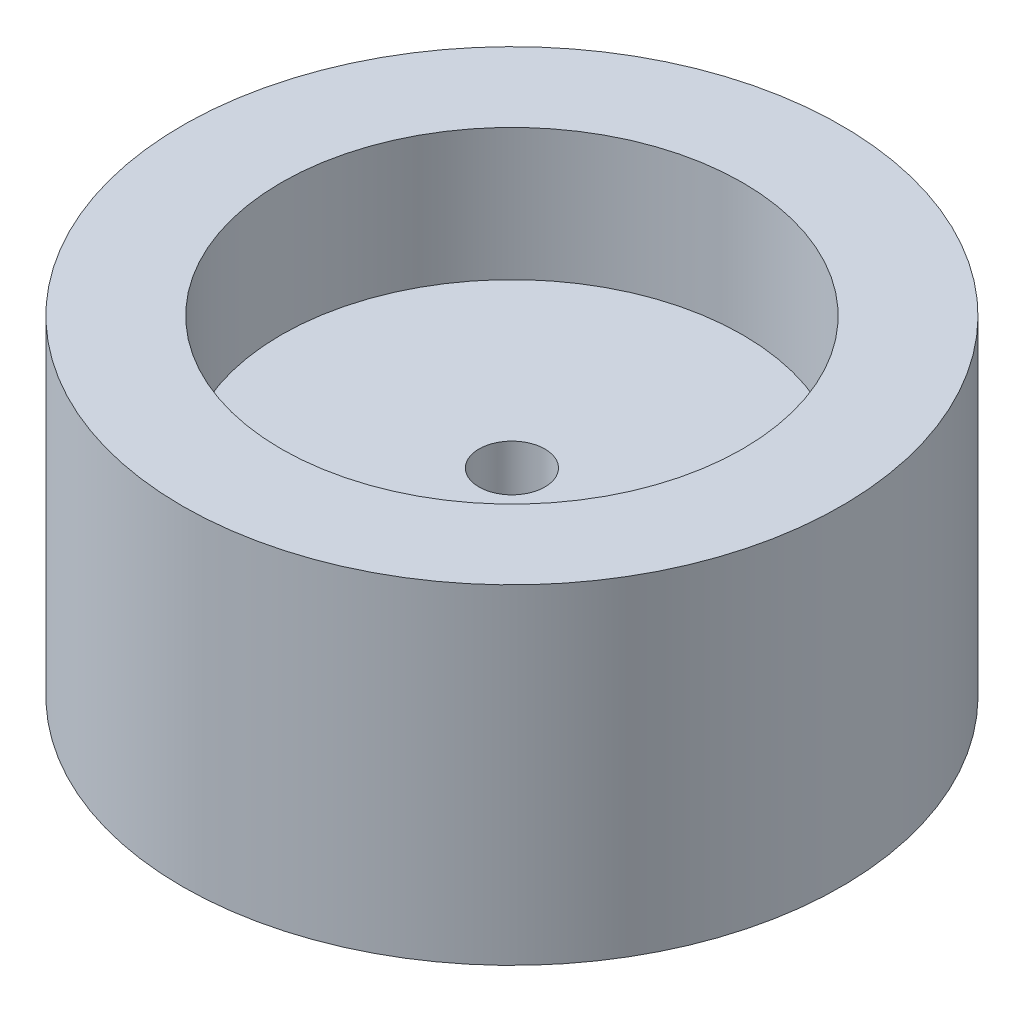
from build123d import *

# Parameters (mm, degrees)
SKETCH_1_R          = 25
EXTRUDE_1_DEPTH     = 25
SKETCH_2_R          = 17.5
CUT_EXTRUDE_1_DEPTH = 10
SKETCH_3_R          = 2.5
CUT_EXTRUDE_2_DEPTH = 39.405728739


with BuildPart() as part:
    # 草图1 → 凸台-拉伸1 (new body)
    with BuildSketch(Plane(origin=(0, 0, 0), x_dir=(1, 0, 0), z_dir=(0, 1, 0))):
        with Locations(Location((0, 0, 0), (0, 0, 270))):
            Circle(SKETCH_1_R)
    extrude(amount=EXTRUDE_1_DEPTH)

    # 草图2 → 切除-拉伸1 (cut)
    with BuildSketch(Plane.XZ):
        with Locations(Location((0, 0, 0), (0, 0, 270))):
            Circle(SKETCH_2_R)
    cut_extrude_1 = extrude(amount=-CUT_EXTRUDE_1_DEPTH, mode=Mode.SUBTRACT)

    # 镜向1: 切除-拉伸1 across plane
    add(cut_extrude_1.mirror(Plane(origin=(0, 12.5, 0), x_dir=(0, 0, 1), z_dir=(0, -1, 0))), mode=Mode.SUBTRACT)

    # 草图3 → 切除-拉伸2 (cut, through all)
    with BuildSketch(Plane.XZ.offset(-10)):
        with Locations(Location((0, 0, 0), (0, 0, 270))):
            Circle(SKETCH_3_R)
    extrude(amount=-CUT_EXTRUDE_2_DEPTH, mode=Mode.SUBTRACT)


solid = part.part
